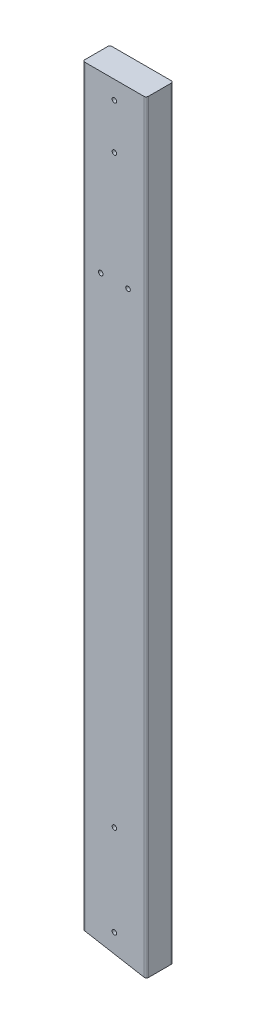
from build123d import *

# Parameters (mm, degrees)
SKETCH1_W                   = 88.9
SKETCH1_H                   = 38.1
BOSS_EXTRUDE1_DEPTH         = 1068.3875
CUT_EXTRUDE1_DEPTH          = 1257.6367532
F_1_4_0_25_DIAMETER_HOLE1_D = 6.35
FILLET1_R                   = 3.175


with BuildPart() as part:
    # Sketch1 → Boss-Extrude1 (new body)
    with BuildSketch(Plane(origin=(0, 0, 0), x_dir=(1, 0, 0), z_dir=(0, 1, 0))):
        Rectangle(SKETCH1_W, SKETCH1_H)
    extrude(amount=BOSS_EXTRUDE1_DEPTH)

    # Sketch2 → Cut-Extrude1 (cut)
    with BuildSketch(Plane.XY.offset(19.05)):
        Polygon((44.45, 0), (-44.45, 15.675468585), (-44.45, 0), align=None)
    extrude(amount=-CUT_EXTRUDE1_DEPTH, mode=Mode.SUBTRACT)

    # 1/4 (0.25) Diameter Hole1 (through all)
    with Locations(Plane.XY.offset(19.05)):
        with Locations((0, 34.225276482), (0, 161.225276482), (19.05, 823.9779812), (-19.05, 823.9779812), (0, 979.4875), (0, 1042.9875)):
            Hole(F_1_4_0_25_DIAMETER_HOLE1_D / 2)

    # Fillet1
    fillet1_edges = [part.edges().sort_by_distance(p)[0] for p in [
        (-44.45, 542.031484292, -19.05),
        (44.45, 534.19375, -19.05),
        (44.45, 534.19375, 19.05),
        (-44.45, 542.031484292, 19.05),
    ]]
    fillet(fillet1_edges, radius=FILLET1_R)


solid = part.part
